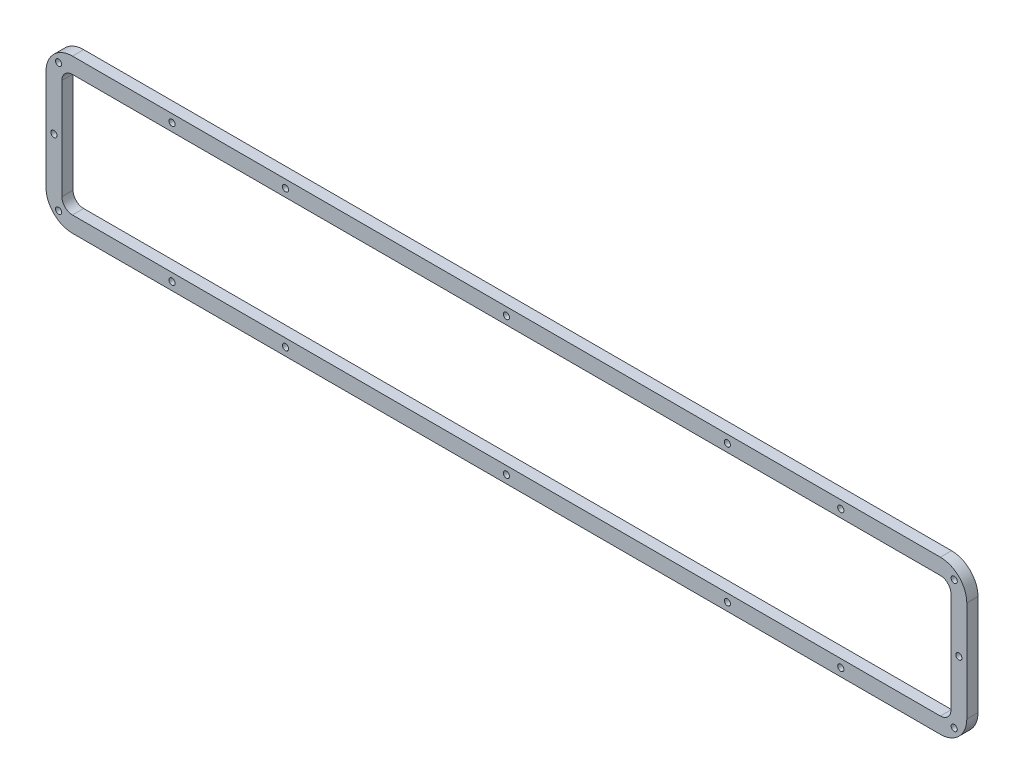
from build123d import *

# Parameters (mm, degrees)
BOSS_EXTRUDE1_DEPTH     = 12.7
SKETCH4_R               = 3.5
CUT_EXTRUDE1_DEPTH      = 530.352708504
CUT_EXTRUDE2_DEPTH      = 530.352708504
CUT_EXTRUDE2_DEPTH_BACK = 530.352708504
SKETCH5_R               = 3.5


with BuildPart() as part:
    # Sketch2 → Boss-Extrude1 (new body)
    with BuildSketch(Plane.XY):
        with BuildLine():
            Line((-492, -87), (492, -87))
            ThreePointArc((492, -87), (513.213203436, -78.213203436), (522, -57))
            Line((522, -57), (522, 57))
            ThreePointArc((522, 57), (513.213203436, 78.213203436), (492, 87))
            Line((492, 87), (-492, 87))
            ThreePointArc((-492, 87), (-513.213203436, 78.213203436), (-522, 57))
            Line((-522, 57), (-522, -57))
            ThreePointArc((-522, -57), (-513.213203436, -78.213203436), (-492, -87))
        make_face()
        with BuildLine():
            Line((-492, -69), (492, -69))
            ThreePointArc((492, -69), (500.485281374, -65.485281374), (504, -57))
            Line((504, -57), (504, 57))
            ThreePointArc((504, 57), (500.485281374, 65.485281374), (492, 69))
            Line((492, 69), (-492, 69))
            ThreePointArc((-492, 69), (-500.485281374, 65.485281374), (-504, 57))
            Line((-504, 57), (-504, -57))
            ThreePointArc((-504, -57), (-500.485281374, -65.485281374), (-492, -69))
        make_face(mode=Mode.SUBTRACT)
    extrude(amount=BOSS_EXTRUDE1_DEPTH)

    # Sketch4 → Cut-Extrude1 (cut, through all)
    with BuildSketch(Plane.XY.offset(12.7)):
        with Locations((-507.727922061, 72.727922061)):
            Circle(SKETCH4_R)
        with Locations((-507.727922061, -72.727922061)):
            Circle(SKETCH4_R)
        with Locations((-250.5, -78)):
            Circle(SKETCH4_R)
        with Locations((-250.5, 78)):
            Circle(SKETCH4_R)
        with Locations((250.5, 78)):
            Circle(SKETCH4_R)
        with Locations((250.5, -78)):
            Circle(SKETCH4_R)
        with Locations((507.727922061, 72.727922061)):
            Circle(SKETCH4_R)
        with Locations((507.727922061, -72.727922061)):
            Circle(SKETCH4_R)
    extrude(amount=-CUT_EXTRUDE1_DEPTH, mode=Mode.SUBTRACT)

    # Sketch5 → Cut-Extrude2 (cut, two sides: drawn at the far end of the back side and taken through both)
    with BuildSketch(Plane.XY.offset(12.7).offset(-CUT_EXTRUDE2_DEPTH_BACK)):
        with Locations((-379.113961031, 78)):
            Circle(SKETCH5_R)
        with Locations((-513, 0)):
            Circle(SKETCH5_R)
        with Locations((-379.113961031, -78)):
            Circle(SKETCH5_R)
        with Locations((0, -78)):
            Circle(SKETCH5_R)
        with Locations((0, 78)):
            Circle(SKETCH5_R)
        with Locations((379.113961031, 78)):
            Circle(SKETCH5_R)
        with Locations((379.113961031, -78)):
            Circle(SKETCH5_R)
        with Locations((513, 0)):
            Circle(SKETCH5_R)
    extrude(amount=CUT_EXTRUDE2_DEPTH + CUT_EXTRUDE2_DEPTH_BACK, mode=Mode.SUBTRACT)


solid = part.part
